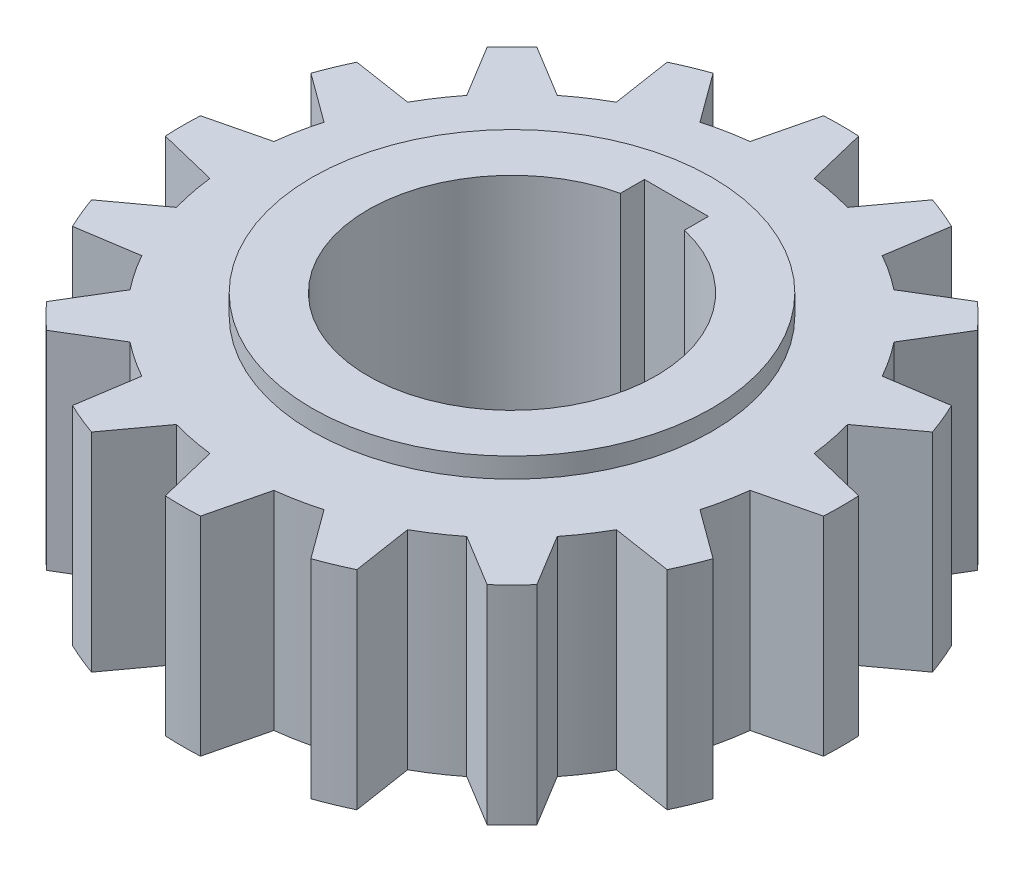
from build123d import *

# Parameters (mm, degrees)
SKETCH1_R           = 105
BOSS_EXTRUDE1_DEPTH = 32.5
SKETCH2_R           = 62.5
BOSS_EXTRUDE2_DEPTH = 38.75
CUT_EXTRUDE1_DEPTH  = 168.5
CUT_EXTRUDE2_DEPTH  = 165.70143442
SKETCH5_R           = 105
SKETCH5_R_2         = 102.995839741
CUT_EXTRUDE3_DEPTH  = 165.70143442


with BuildPart() as part:
    # Sketch1 → Boss-Extrude1 (new, symmetric)
    with BuildSketch(Plane(origin=(0, 0, 0), x_dir=(1, 0, 0), z_dir=(0, 1, 0))):
        with Locations(Location((0, 0, 0), (0, 0, 270))):
            Circle(SKETCH1_R)
    extrude(amount=BOSS_EXTRUDE1_DEPTH, both=True)

    # Sketch2 → Boss-Extrude2 (add, symmetric)
    with BuildSketch(Plane(origin=(0, 0, 0), x_dir=(1, 0, 0), z_dir=(0, 1, 0))):
        with Locations(Location((0, 0, 0), (0, 0, 270))):
            Circle(SKETCH2_R)
    extrude(amount=BOSS_EXTRUDE2_DEPTH, both=True)

    # Sketch3 → Cut-Extrude1 (cut, through all)
    with BuildSketch(Plane(origin=(0, 38.75, 0), x_dir=(1, 0, 0), z_dir=(0, 1, 0))):
        with BuildLine():
            Line((-10, 43.874821937), (-10, 51.374821937))
            Line((-10, 51.374821937), (10, 51.374821937))
            Line((10, 51.374821937), (10, 43.874821937))
            ThreePointArc((10, 43.874821937), (0, -45), (-10, 43.874821937))
        make_face()
    extrude(amount=-CUT_EXTRUDE1_DEPTH, mode=Mode.SUBTRACT)

    # Sketch4 → Cut-Extrude2 (cut, through all)
    with BuildSketch(Plane(origin=(0, 32.5, 0), x_dir=(1, 0, 0), z_dir=(0, 1, 0))):
        with BuildLine():
            Line((-5, 104.880884817), (-10, 84.409715081))
            ThreePointArc((-10, 84.409715081), (-16.582677371, 83.366748834), (-23.063404167, 81.811242432))
            Line((-23.063404167, 81.811242432), (-35.516779329, 98.810719996))
            ThreePointArc((-35.516779329, 98.810719996), (-20.484483812, 102.982454442), (-5, 104.880884817))
        make_face()
        with BuildLine():
            Line((5, 104.880884817), (10, 84.409715081))
            ThreePointArc((10, 84.409715081), (16.582677371, 83.366748834), (23.063404167, 81.811242432))
            Line((23.063404167, 81.811242432), (35.516779329, 98.810719996))
            ThreePointArc((35.516779329, 98.810719996), (20.484483812, 102.982454442), (5, 104.880884817))
        make_face()
        with BuildLine():
            Line((44.755574654, 94.983885672), (41.540994817, 74.157573784))
            ThreePointArc((41.540994817, 74.157573784), (47.223469807, 70.674917046), (52.61561412, 66.757749743))
            Line((52.61561412, 66.757749743), (70.626450965, 77.697518777))
            ThreePointArc((70.626450965, 77.697518777), (58.334874467, 87.304309292), (44.755574654, 94.983885672))
        make_face()
        with BuildLine():
            Line((77.697518777, 70.626450965), (66.757749743, 52.61561412))
            ThreePointArc((66.757749743, 52.61561412), (70.674917046, 47.223469807), (74.157573784, 41.540994817))
            Line((74.157573784, 41.540994817), (94.983885672, 44.755574654))
            ThreePointArc((94.983885672, 44.755574654), (87.304309292, 58.334874467), (77.697518777, 70.626450965))
        make_face()
        with BuildLine():
            Line((98.810719996, 35.516779329), (81.811242432, 23.063404167))
            ThreePointArc((81.811242432, 23.063404167), (83.366748834, 16.582677371), (84.409715081, 10))
            Line((84.409715081, 10), (104.880884817, 5))
            ThreePointArc((104.880884817, 5), (102.982454442, 20.484483812), (98.810719996, 35.516779329))
        make_face()
        with BuildLine():
            Line((104.880884817, -5), (84.409715081, -10))
            ThreePointArc((84.409715081, -10), (83.366748834, -16.582677371), (81.811242432, -23.063404167))
            Line((81.811242432, -23.063404167), (98.810719996, -35.516779329))
            ThreePointArc((98.810719996, -35.516779329), (102.982454442, -20.484483812), (104.880884817, -5))
        make_face()
        with BuildLine():
            Line((94.983885672, -44.755574654), (74.157573784, -41.540994817))
            ThreePointArc((74.157573784, -41.540994817), (70.674917046, -47.223469807), (66.757749743, -52.61561412))
            Line((66.757749743, -52.61561412), (77.697518777, -70.626450965))
            ThreePointArc((77.697518777, -70.626450965), (87.304309292, -58.334874467), (94.983885672, -44.755574654))
        make_face()
        with BuildLine():
            Line((70.626450965, -77.697518777), (52.61561412, -66.757749743))
            ThreePointArc((52.61561412, -66.757749743), (47.223469807, -70.674917046), (41.540994817, -74.157573784))
            Line((41.540994817, -74.157573784), (44.755574654, -94.983885672))
            ThreePointArc((44.755574654, -94.983885672), (58.334874467, -87.304309292), (70.626450965, -77.697518777))
        make_face()
        with BuildLine():
            Line((35.516779329, -98.810719996), (23.063404167, -81.811242432))
            ThreePointArc((23.063404167, -81.811242432), (16.582677371, -83.366748834), (10, -84.409715081))
            Line((10, -84.409715081), (5, -104.880884817))
            ThreePointArc((5, -104.880884817), (20.484483812, -102.982454442), (35.516779329, -98.810719996))
        make_face()
        with BuildLine():
            Line((-5, -104.880884817), (-10, -84.409715081))
            ThreePointArc((-10, -84.409715081), (-16.582677371, -83.366748834), (-23.063404167, -81.811242432))
            Line((-23.063404167, -81.811242432), (-35.516779329, -98.810719996))
            ThreePointArc((-35.516779329, -98.810719996), (-20.484483812, -102.982454442), (-5, -104.880884817))
        make_face()
        with BuildLine():
            Line((-44.755574654, -94.983885672), (-41.540994817, -74.157573784))
            ThreePointArc((-41.540994817, -74.157573784), (-47.223469807, -70.674917046), (-52.61561412, -66.757749743))
            Line((-52.61561412, -66.757749743), (-70.626450965, -77.697518777))
            ThreePointArc((-70.626450965, -77.697518777), (-58.334874467, -87.304309292), (-44.755574654, -94.983885672))
        make_face()
        with BuildLine():
            Line((-77.697518777, -70.626450965), (-66.757749743, -52.61561412))
            ThreePointArc((-66.757749743, -52.61561412), (-70.674917046, -47.223469807), (-74.157573784, -41.540994817))
            Line((-74.157573784, -41.540994817), (-94.983885672, -44.755574654))
            ThreePointArc((-94.983885672, -44.755574654), (-87.304309292, -58.334874467), (-77.697518777, -70.626450965))
        make_face()
        with BuildLine():
            Line((-98.810719996, -35.516779329), (-81.811242432, -23.063404167))
            ThreePointArc((-81.811242432, -23.063404167), (-83.366748834, -16.582677371), (-84.409715081, -10))
            Line((-84.409715081, -10), (-104.880884817, -5))
            ThreePointArc((-104.880884817, -5), (-102.982454442, -20.484483812), (-98.810719996, -35.516779329))
        make_face()
        with BuildLine():
            Line((-104.880884817, 5), (-84.409715081, 10))
            ThreePointArc((-84.409715081, 10), (-83.366748834, 16.582677371), (-81.811242432, 23.063404167))
            Line((-81.811242432, 23.063404167), (-98.810719996, 35.516779329))
            ThreePointArc((-98.810719996, 35.516779329), (-102.982454442, 20.484483812), (-104.880884817, 5))
        make_face()
        with BuildLine():
            Line((-94.983885672, 44.755574654), (-74.157573784, 41.540994817))
            ThreePointArc((-74.157573784, 41.540994817), (-70.674917046, 47.223469807), (-66.757749743, 52.61561412))
            Line((-66.757749743, 52.61561412), (-77.697518777, 70.626450965))
            ThreePointArc((-77.697518777, 70.626450965), (-87.304309292, 58.334874467), (-94.983885672, 44.755574654))
        make_face()
        with BuildLine():
            Line((-70.626450965, 77.697518777), (-52.61561412, 66.757749743))
            ThreePointArc((-52.61561412, 66.757749743), (-47.223469807, 70.674917046), (-41.540994817, 74.157573784))
            Line((-41.540994817, 74.157573784), (-44.755574654, 94.983885672))
            ThreePointArc((-44.755574654, 94.983885672), (-58.334874467, 87.304309292), (-70.626450965, 77.697518777))
        make_face()
    extrude(amount=-CUT_EXTRUDE2_DEPTH, mode=Mode.SUBTRACT)

    # Sketch5 → Cut-Extrude3 (cut, through all)
    with BuildSketch(Plane(origin=(0, 32.5, 0), x_dir=(1, 0, 0), z_dir=(0, 1, 0))):
        Circle(SKETCH5_R)
        Circle(SKETCH5_R_2, mode=Mode.SUBTRACT)
    extrude(amount=-CUT_EXTRUDE3_DEPTH, mode=Mode.SUBTRACT)


solid = part.part
